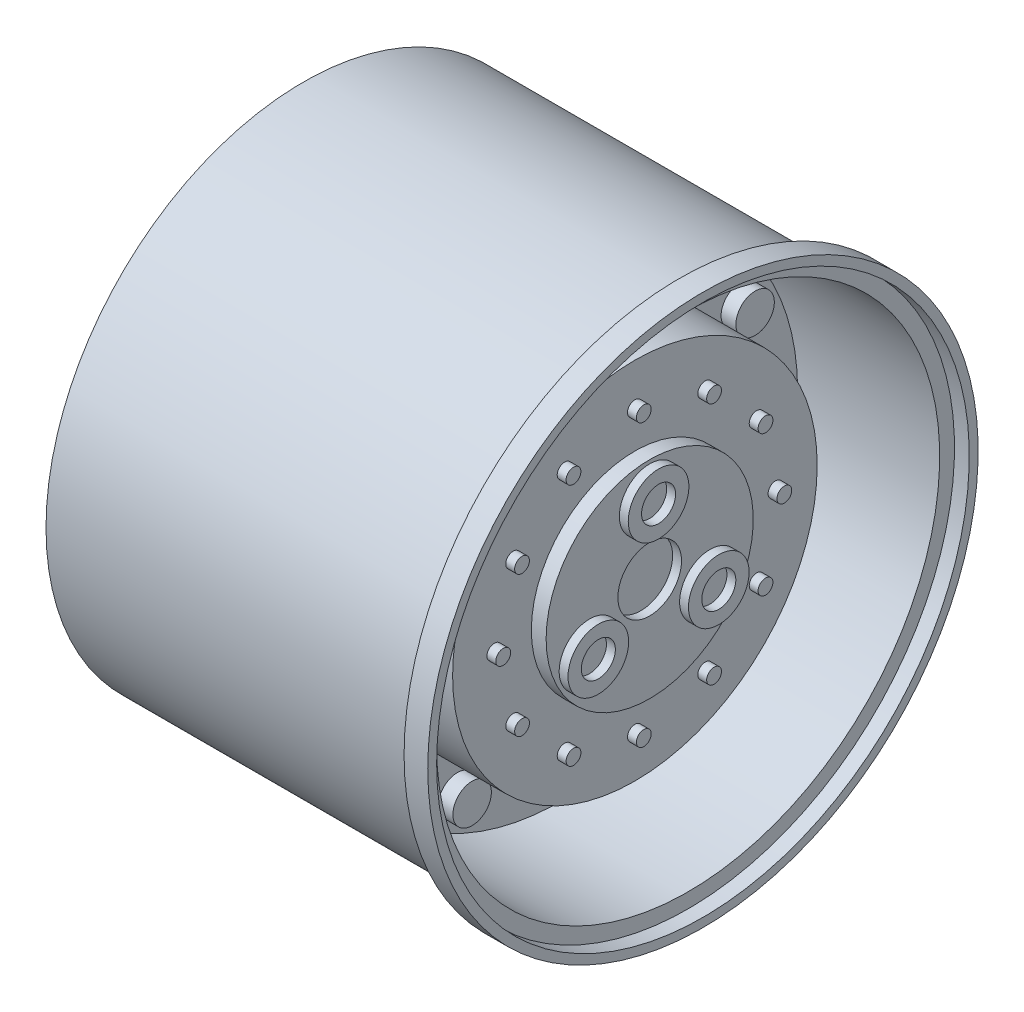
from build123d import *

# Parameters (mm, degrees)
SKETCH2_R           = 8.255
BOSS_EXTRUDE1_DEPTH = 6.35
SKETCH3_R           = 3.175
BOSS_EXTRUDE2_DEPTH = 3.81
SKETCH5_R           = 13.0175
SKETCH5_R_2         = 7.3025
BOSS_EXTRUDE5_DEPTH = 3.81
SKETCH4_R           = 13.6525
CUT_EXTRUDE1_DEPTH  = 3.81
SKETCH6_R           = 3.175
BOSS_EXTRUDE6_DEPTH = 3.81
SKETCH7_R           = 19.05
CUT_EXTRUDE2_DEPTH  = 31.75


with BuildPart() as part:
    # Sketch1 → Revolve1 (revolve)
    with BuildSketch(Plane.XY, mode=Mode.PRIVATE) as revolve1_sk:
        Polygon((0, 0), (59.69, 0), (59.69, 44.45), (53.34, 44.45), (53.34, 78.232), (21.59, 78.232), (21.59, 101.6), (2.54, 101.6), (2.54, 107.95), (76.2, 107.95), (76.2, 114.3), (82.55, 114.3), (82.55, 118.11), (72.39, 118.11), (72.39, 110.49), (-88.9, 110.49), (-88.9, 105.41), (-63.5, 105.41), (-63.5, 101.6), (-38.1, 101.6), (-38.1, 78.74), (-44.45, 78.74), (-44.45, 64.77), (-76.2, 64.77), (-76.2, 0), align=None)
    revolve(revolve1_sk.sketch.rotate(Axis((0, 0, 0), (1, 0, 0)), 90), axis=Axis((0, 0, 0), (1, 0, 0)))

    # Sketch2 → Boss-Extrude1 (add)
    with BuildSketch(Plane(origin=(21.59, 0, 0), x_dir=(0, 0, -1), z_dir=(1, 0, 0))):
        with Locations(Location((0, 88.9, 0), (0, 0, 180))):
            Circle(SKETCH2_R)
        with Locations(Location((44.45, 76.989658396, 0), (0, 0, 180))):
            Circle(SKETCH2_R)
        with Locations(Location((76.989658396, 44.45, 0), (0, 0, 180))):
            Circle(SKETCH2_R)
        with Locations(Location((88.9, 0, 0), (0, 0, 180))):
            Circle(SKETCH2_R)
        with Locations(Location((76.989658396, -44.45, 0), (0, 0, 180))):
            Circle(SKETCH2_R)
        with Locations(Location((44.45, -76.989658396, 0), (0, 0, 180))):
            Circle(SKETCH2_R)
        with Locations(Location((0, -88.9, 0), (0, 0, 180))):
            Circle(SKETCH2_R)
        with Locations(Location((-44.45, -76.989658396, 0), (0, 0, 180))):
            Circle(SKETCH2_R)
        with Locations(Location((-76.989658396, -44.45, 0), (0, 0, 180))):
            Circle(SKETCH2_R)
        with Locations(Location((-88.9, 0, 0), (0, 0, 180))):
            Circle(SKETCH2_R)
        with Locations(Location((-76.989658396, 44.45, 0), (0, 0, 180))):
            Circle(SKETCH2_R)
        with Locations(Location((-44.45, 76.989658396, 0), (0, 0, 180))):
            Circle(SKETCH2_R)
    extrude(amount=BOSS_EXTRUDE1_DEPTH)

    # Sketch3 → Boss-Extrude2 (add)
    with BuildSketch(Plane(origin=(53.34, 0, 0), x_dir=(0, 0, -1), z_dir=(1, 0, 0))):
        with Locations(Location((0, 60.325, 0), (0, 0, 180))):
            Circle(SKETCH3_R)
        with Locations(Location((30.1625, 52.242982483, 0), (0, 0, 180))):
            Circle(SKETCH3_R)
        with Locations(Location((52.242982483, 30.1625, 0), (0, 0, 180))):
            Circle(SKETCH3_R)
        with Locations(Location((60.325, 0, 0), (0, 0, 180))):
            Circle(SKETCH3_R)
        with Locations(Location((52.242982483, -30.1625, 0), (0, 0, 180))):
            Circle(SKETCH3_R)
        with Locations(Location((30.1625, -52.242982483, 0), (0, 0, 180))):
            Circle(SKETCH3_R)
        with Locations(Location((0, -60.325, 0), (0, 0, 180))):
            Circle(SKETCH3_R)
        with Locations(Location((-30.1625, -52.242982483, 0), (0, 0, 180))):
            Circle(SKETCH3_R)
        with Locations(Location((-52.242982483, -30.1625, 0), (0, 0, 180))):
            Circle(SKETCH3_R)
        with Locations(Location((-60.325, 0, 0), (0, 0, 180))):
            Circle(SKETCH3_R)
        with Locations(Location((-52.242982483, 30.1625, 0), (0, 0, 180))):
            Circle(SKETCH3_R)
        with Locations(Location((-30.1625, 52.242982483, 0), (0, 0, 180))):
            Circle(SKETCH3_R)
    extrude(amount=BOSS_EXTRUDE2_DEPTH)

    # Sketch5 → Boss-Extrude5 (add)
    # profile 1 of 3: a face of its own
    with BuildSketch(Plane(origin=(59.69, 0, 0), x_dir=(0, 0, -1), z_dir=(1, 0, 0))):
        with Locations(Location((0, 29.845, 0), (0, 0, 180))):
            Circle(SKETCH5_R)
        with Locations(Location((0, 29.845, 0), (0, 0, 180))):
            Circle(SKETCH5_R_2, mode=Mode.SUBTRACT)
    # profile 2 of 3: a face of its own
    with BuildSketch(Plane(origin=(59.69, 0, 0), x_dir=(0, 0, -1), z_dir=(1, 0, 0))):
        with Locations(Location((25.846528176, -14.9225, 0), (0, 0, 180))):
            Circle(SKETCH5_R)
        with Locations(Location((25.846528176, -14.9225, 0), (0, 0, 180))):
            Circle(SKETCH5_R_2, mode=Mode.SUBTRACT)
    # profile 3 of 3: a face of its own
    with BuildSketch(Plane(origin=(59.69, 0, 0), x_dir=(0, 0, -1), z_dir=(1, 0, 0))):
        with Locations(Location((-25.846528176, -14.9225, 0), (0, 0, 180))):
            Circle(SKETCH5_R)
        with Locations(Location((-25.846528176, -14.9225, 0), (0, 0, 180))):
            Circle(SKETCH5_R_2, mode=Mode.SUBTRACT)
    extrude(amount=BOSS_EXTRUDE5_DEPTH)

    # Sketch4 → Cut-Extrude1 (cut)
    with BuildSketch(Plane(origin=(59.69, 0, 0), x_dir=(0, 0, -1), z_dir=(1, 0, 0))):
        Circle(SKETCH4_R)
    extrude(amount=-CUT_EXTRUDE1_DEPTH, mode=Mode.SUBTRACT)

    # Sketch6 → Boss-Extrude6 (add)
    with BuildSketch(Plane.ZY.offset(44.45)):
        with Locations(Location((0, 69.85, 0), (0, 0, 180))):
            Circle(SKETCH6_R)
        with Locations(Location((34.925, 60.491874454, 0), (0, 0, 180))):
            Circle(SKETCH6_R)
        with Locations(Location((60.491874454, 34.925, 0), (0, 0, 180))):
            Circle(SKETCH6_R)
        with Locations(Location((69.85, 0, 0), (0, 0, 180))):
            Circle(SKETCH6_R)
        with Locations(Location((60.491874454, -34.925, 0), (0, 0, 180))):
            Circle(SKETCH6_R)
        with Locations(Location((34.925, -60.491874454, 0), (0, 0, 180))):
            Circle(SKETCH6_R)
        with Locations(Location((0, -69.85, 0), (0, 0, 180))):
            Circle(SKETCH6_R)
        with Locations(Location((-34.925, -60.491874454, 0), (0, 0, 180))):
            Circle(SKETCH6_R)
        with Locations(Location((-60.491874454, -34.925, 0), (0, 0, 180))):
            Circle(SKETCH6_R)
        with Locations(Location((-69.85, 0, 0), (0, 0, 180))):
            Circle(SKETCH6_R)
        with Locations(Location((-60.491874454, 34.925, 0), (0, 0, 180))):
            Circle(SKETCH6_R)
        with Locations(Location((-34.925, 60.491874454, 0), (0, 0, 180))):
            Circle(SKETCH6_R)
    extrude(amount=BOSS_EXTRUDE6_DEPTH)

    # Sketch7 → Cut-Extrude2 (cut)
    with BuildSketch(Plane.ZY.offset(76.2)):
        Circle(SKETCH7_R)
    extrude(amount=-CUT_EXTRUDE2_DEPTH, mode=Mode.SUBTRACT)


solid = part.part
